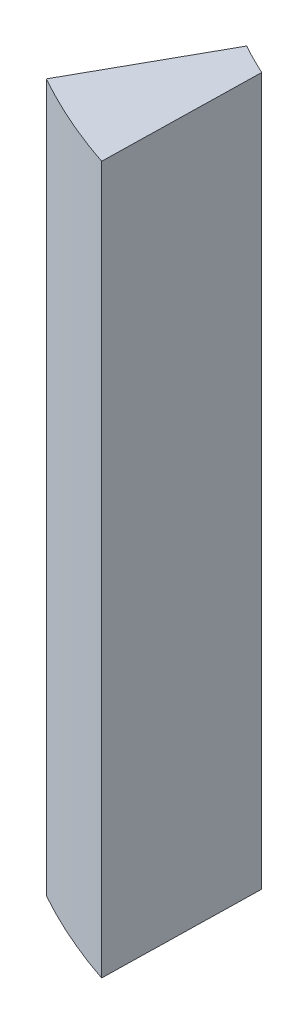
from build123d import *

# Parameters (mm, degrees)
BOSS_EXTRUDE1_DEPTH = 48


with BuildPart() as part:
    # Sketch1 → Boss-Extrude1 (new body)
    with BuildSketch(Plane(origin=(0, 0, 0), x_dir=(0.9999530758491465, 0, -0.009687419668383268), z_dir=(0, 1, 0))):
        with BuildLine():
            Line((-41.314383982, -20.77443632), (-46.26820393, -29.461156439))
            ThreePointArc((-46.26820393, -29.461156439), (-42.993051469, -31.13201524), (-39.576799535, -32.491285451))
            Line((-39.576799535, -32.491285451), (-39.2598183, -21.865759848))
            Line((-39.2598183, -21.865759848), (-39.2591075, -21.841933141))
            ThreePointArc((-39.2591075, -21.841933141), (-40.297217765, -21.328346763), (-41.314383982, -20.77443632))
        make_face()
    extrude(amount=BOSS_EXTRUDE1_DEPTH)


solid = part.part
